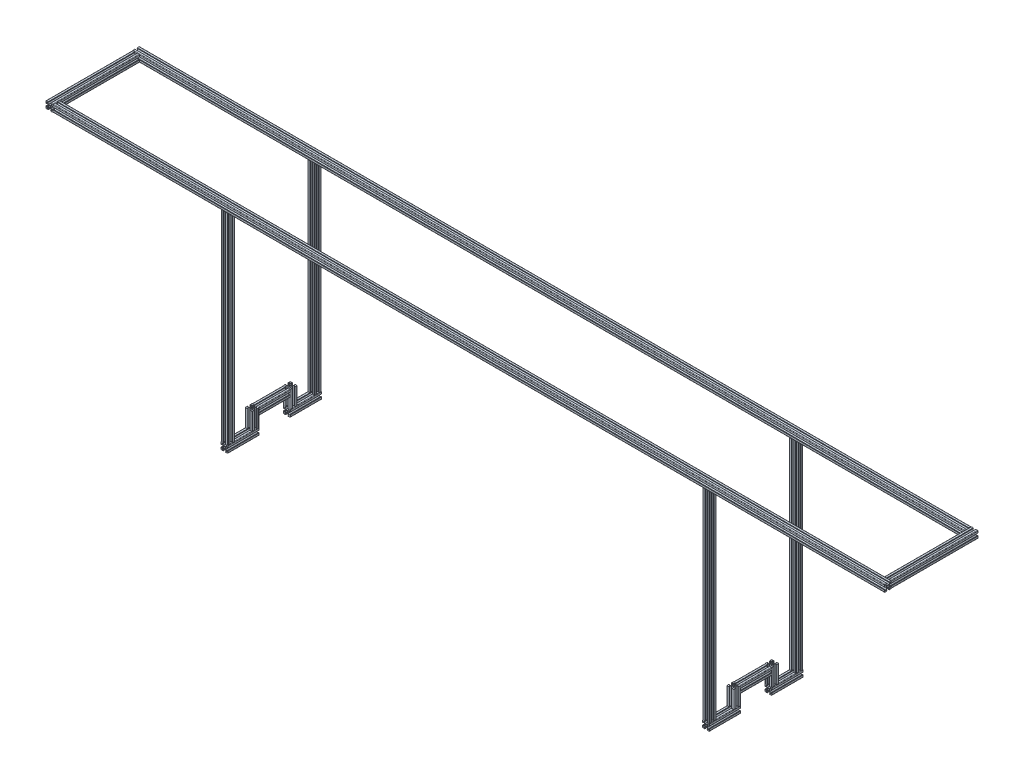
from build123d import *

# Parameters (mm, degrees)
F_20_X_20_X_R1_5_1_DEPTH      = 251
F_20_X_20_X_R1_5_1_DEPTH_BACK = 10
SKETCH14_R                    = 2.5
SKETCH14_ON_SEGMENT_2_R       = 2.5
F_20_X_20_X_R1_5_1_2_DEPTH    = 2411
SKETCH14_ON_SEGMENT_3_R       = 2.5
F_20_X_20_X_R1_5_1_3_DEPTH    = 261
SKETCH14_ON_SEGMENT_4_R       = 2.5
F_20_X_20_X_R1_5_1_4_DEPTH    = 2411
SKETCH14_ON_SEGMENT_5_R       = 2.5
F_20_X_20_X_R1_5_1_5_DEPTH    = 90
SKETCH14_ON_SEGMENT_6_R       = 2.5
F_20_X_20_X_R1_5_1_6_DEPTH    = 90
SKETCH14_ON_SEGMENT_7_R       = 2.5
F_20_X_20_X_R1_5_1_7_DEPTH    = 90
SKETCH14_ON_SEGMENT_8_R       = 2.5
F_20_X_20_X_R1_5_1_8_DEPTH    = 90
SKETCH14_ON_SEGMENT_9_R       = 2.5
F_20_X_20_X_R1_5_1_9_DEPTH    = 602
SKETCH14_ON_SEGMENT_10_R      = 2.5
F_20_X_20_X_R1_5_1_10_DEPTH   = 602
SKETCH14_ON_SEGMENT_11_R      = 2.5
F_20_X_20_X_R1_5_1_11_DEPTH   = 602
SKETCH14_ON_SEGMENT_12_R      = 2.5
F_20_X_20_X_R1_5_1_12_DEPTH   = 602
SKETCH14_ON_SEGMENT_13_R      = 2.5
F_20_X_20_X_R1_5_1_13_DEPTH   = 61
SKETCH14_ON_SEGMENT_14_R      = 2.5
F_20_X_20_X_R1_5_1_14_DEPTH   = 61
SKETCH14_ON_SEGMENT_15_R      = 2.5
F_20_X_20_X_R1_5_1_15_DEPTH   = 61
SKETCH14_ON_SEGMENT_16_R      = 2.5
F_20_X_20_X_R1_5_1_16_DEPTH   = 61
SKETCH14_ON_SEGMENT_17_R      = 2.5
F_20_X_20_X_R1_5_1_17_DEPTH   = 112
SKETCH14_ON_SEGMENT_18_R      = 2.5
F_20_X_20_X_R1_5_1_18_DEPTH   = 112


with BuildPart() as part:
    # Sketch14 → 工业铝型材 20 X 20 X R1.5(1) (new, two sides: drawn at the far end of the back side and taken through both)
    with BuildSketch(Plane(origin=(0, 600, 0), x_dir=(1, 0, 0), z_dir=(0, 0, -1)).offset(-F_20_X_20_X_R1_5_1_DEPTH_BACK)):
        with BuildLine():
            Line((-3.6, 10), (-3.6, 9.5))
            Line((-3.6, 9.5), (-3.1, 9.5))
            Line((-3.1, 9.5), (-3.1, 8.5))
            Line((-3.1, 8.5), (-5.5, 8.5))
            Line((-5.5, 8.5), (-5.5, 6.65))
            Line((-5.5, 6.65), (-2.75, 3.9))
            Line((-2.75, 3.9), (2.75, 3.9))
            Line((2.75, 3.9), (5.5, 6.65))
            Line((5.5, 6.65), (5.5, 8.5))
            Line((5.5, 8.5), (3.1, 8.5))
            Line((3.1, 8.5), (3.1, 9.5))
            Line((3.1, 9.5), (3.6, 9.5))
            Line((3.6, 9.5), (3.6, 10))
            Line((3.6, 10), (8.5, 10))
            ThreePointArc((8.5, 10), (9.560660172, 9.560660172), (10, 8.5))
            Line((10, 8.5), (10, 3.6))
            Line((10, 3.6), (9.5, 3.6))
            Line((9.5, 3.6), (9.5, 3.1))
            Line((9.5, 3.1), (8.5, 3.1))
            Line((8.5, 3.1), (8.5, 5.5))
            Line((8.5, 5.5), (6.65, 5.5))
            Line((6.65, 5.5), (3.9, 2.75))
            Line((3.9, 2.75), (3.9, -2.75))
            Line((3.9, -2.75), (6.65, -5.5))
            Line((6.65, -5.5), (8.5, -5.5))
            Line((8.5, -5.5), (8.5, -3.1))
            Line((8.5, -3.1), (9.5, -3.1))
            Line((9.5, -3.1), (9.5, -3.6))
            Line((9.5, -3.6), (10, -3.6))
            Line((10, -3.6), (10, -8.5))
            ThreePointArc((10, -8.5), (9.560660172, -9.560660172), (8.5, -10))
            Line((8.5, -10), (3.6, -10))
            Line((3.6, -10), (3.6, -9.5))
            Line((3.6, -9.5), (3.1, -9.5))
            Line((3.1, -9.5), (3.1, -8.5))
            Line((3.1, -8.5), (5.5, -8.5))
            Line((5.5, -8.5), (5.5, -6.65))
            Line((5.5, -6.65), (2.75, -3.9))
            Line((2.75, -3.9), (-2.75, -3.9))
            Line((-2.75, -3.9), (-5.5, -6.65))
            Line((-5.5, -6.65), (-5.5, -8.5))
            Line((-5.5, -8.5), (-3.1, -8.5))
            Line((-3.1, -8.5), (-3.1, -9.5))
            Line((-3.1, -9.5), (-3.6, -9.5))
            Line((-3.6, -9.5), (-3.6, -10))
            Line((-3.6, -10), (-8.5, -10))
            ThreePointArc((-8.5, -10), (-9.560660172, -9.560660172), (-10, -8.5))
            Line((-10, -8.5), (-10, -3.6))
            Line((-10, -3.6), (-9.5, -3.6))
            Line((-9.5, -3.6), (-9.5, -3.1))
            Line((-9.5, -3.1), (-8.5, -3.1))
            Line((-8.5, -3.1), (-8.5, -5.5))
            Line((-8.5, -5.5), (-6.65, -5.5))
            Line((-6.65, -5.5), (-3.9, -2.75))
            Line((-3.9, -2.75), (-3.9, 2.75))
            Line((-3.9, 2.75), (-6.65, 5.5))
            Line((-6.65, 5.5), (-8.5, 5.5))
            Line((-8.5, 5.5), (-8.5, 3.1))
            Line((-8.5, 3.1), (-9.5, 3.1))
            Line((-9.5, 3.1), (-9.5, 3.6))
            Line((-9.5, 3.6), (-10, 3.6))
            Line((-10, 3.6), (-10, 8.5))
            ThreePointArc((-10, 8.5), (-9.560660172, 9.560660172), (-8.5, 10))
            Line((-8.5, 10), (-3.6, 10))
        make_face()
        Circle(SKETCH14_R, mode=Mode.SUBTRACT)
    extrude(amount=F_20_X_20_X_R1_5_1_DEPTH + F_20_X_20_X_R1_5_1_DEPTH_BACK)

    # 工业铝型材 20 X 20 X R1.5(1) end butt 1
    split(bisect_by=Plane(origin=(0, 600, -240), x_dir=(0, -1, 0), z_dir=(0, 0, 1)), keep=Keep.TOP)


with BuildPart() as body_2:
    # Sketch14 on segment 2 (carried to segment 2) → 20 X 20 X R1.5_1 2 (new body)
    with BuildSketch(Plane(origin=(-10, 600, -250), x_dir=(0, 0, 1), z_dir=(1, 0, 0))):
        with BuildLine():
            Line((-3.6, 10), (-3.6, 9.5))
            Line((-3.6, 9.5), (-3.1, 9.5))
            Line((-3.1, 9.5), (-3.1, 8.5))
            Line((-3.1, 8.5), (-5.5, 8.5))
            Line((-5.5, 8.5), (-5.5, 6.65))
            Line((-5.5, 6.65), (-2.75, 3.9))
            Line((-2.75, 3.9), (2.75, 3.9))
            Line((2.75, 3.9), (5.5, 6.65))
            Line((5.5, 6.65), (5.5, 8.5))
            Line((5.5, 8.5), (3.1, 8.5))
            Line((3.1, 8.5), (3.1, 9.5))
            Line((3.1, 9.5), (3.6, 9.5))
            Line((3.6, 9.5), (3.6, 10))
            Line((3.6, 10), (8.5, 10))
            ThreePointArc((8.5, 10), (9.560660172, 9.560660172), (10, 8.5))
            Line((10, 8.5), (10, 3.6))
            Line((10, 3.6), (9.5, 3.6))
            Line((9.5, 3.6), (9.5, 3.1))
            Line((9.5, 3.1), (8.5, 3.1))
            Line((8.5, 3.1), (8.5, 5.5))
            Line((8.5, 5.5), (6.65, 5.5))
            Line((6.65, 5.5), (3.9, 2.75))
            Line((3.9, 2.75), (3.9, -2.75))
            Line((3.9, -2.75), (6.65, -5.5))
            Line((6.65, -5.5), (8.5, -5.5))
            Line((8.5, -5.5), (8.5, -3.1))
            Line((8.5, -3.1), (9.5, -3.1))
            Line((9.5, -3.1), (9.5, -3.6))
            Line((9.5, -3.6), (10, -3.6))
            Line((10, -3.6), (10, -8.5))
            ThreePointArc((10, -8.5), (9.560660172, -9.560660172), (8.5, -10))
            Line((8.5, -10), (3.6, -10))
            Line((3.6, -10), (3.6, -9.5))
            Line((3.6, -9.5), (3.1, -9.5))
            Line((3.1, -9.5), (3.1, -8.5))
            Line((3.1, -8.5), (5.5, -8.5))
            Line((5.5, -8.5), (5.5, -6.65))
            Line((5.5, -6.65), (2.75, -3.9))
            Line((2.75, -3.9), (-2.75, -3.9))
            Line((-2.75, -3.9), (-5.5, -6.65))
            Line((-5.5, -6.65), (-5.5, -8.5))
            Line((-5.5, -8.5), (-3.1, -8.5))
            Line((-3.1, -8.5), (-3.1, -9.5))
            Line((-3.1, -9.5), (-3.6, -9.5))
            Line((-3.6, -9.5), (-3.6, -10))
            Line((-3.6, -10), (-8.5, -10))
            ThreePointArc((-8.5, -10), (-9.560660172, -9.560660172), (-10, -8.5))
            Line((-10, -8.5), (-10, -3.6))
            Line((-10, -3.6), (-9.5, -3.6))
            Line((-9.5, -3.6), (-9.5, -3.1))
            Line((-9.5, -3.1), (-8.5, -3.1))
            Line((-8.5, -3.1), (-8.5, -5.5))
            Line((-8.5, -5.5), (-6.65, -5.5))
            Line((-6.65, -5.5), (-3.9, -2.75))
            Line((-3.9, -2.75), (-3.9, 2.75))
            Line((-3.9, 2.75), (-6.65, 5.5))
            Line((-6.65, 5.5), (-8.5, 5.5))
            Line((-8.5, 5.5), (-8.5, 3.1))
            Line((-8.5, 3.1), (-9.5, 3.1))
            Line((-9.5, 3.1), (-9.5, 3.6))
            Line((-9.5, 3.6), (-10, 3.6))
            Line((-10, 3.6), (-10, 8.5))
            ThreePointArc((-10, 8.5), (-9.560660172, 9.560660172), (-8.5, 10))
            Line((-8.5, 10), (-3.6, 10))
        make_face()
        Circle(SKETCH14_ON_SEGMENT_2_R, mode=Mode.SUBTRACT)
    extrude(amount=F_20_X_20_X_R1_5_1_2_DEPTH)

    # 20 X 20 X R1.5_1 2 end butt 1
    split(bisect_by=Plane(origin=(2390, 600, -250), x_dir=(0, -1, 0), z_dir=(-1, 0, 0)), keep=Keep.TOP)


with BuildPart() as body_3:
    # Sketch14 on segment 3 (carried to segment 3) → 20 X 20 X R1.5_1 3 (new body)
    with BuildSketch(Plane(origin=(2400, 600, -260), x_dir=(-1, 0, 0), z_dir=(0, 0, 1))):
        with BuildLine():
            Line((-3.6, 10), (-3.6, 9.5))
            Line((-3.6, 9.5), (-3.1, 9.5))
            Line((-3.1, 9.5), (-3.1, 8.5))
            Line((-3.1, 8.5), (-5.5, 8.5))
            Line((-5.5, 8.5), (-5.5, 6.65))
            Line((-5.5, 6.65), (-2.75, 3.9))
            Line((-2.75, 3.9), (2.75, 3.9))
            Line((2.75, 3.9), (5.5, 6.65))
            Line((5.5, 6.65), (5.5, 8.5))
            Line((5.5, 8.5), (3.1, 8.5))
            Line((3.1, 8.5), (3.1, 9.5))
            Line((3.1, 9.5), (3.6, 9.5))
            Line((3.6, 9.5), (3.6, 10))
            Line((3.6, 10), (8.5, 10))
            ThreePointArc((8.5, 10), (9.560660172, 9.560660172), (10, 8.5))
            Line((10, 8.5), (10, 3.6))
            Line((10, 3.6), (9.5, 3.6))
            Line((9.5, 3.6), (9.5, 3.1))
            Line((9.5, 3.1), (8.5, 3.1))
            Line((8.5, 3.1), (8.5, 5.5))
            Line((8.5, 5.5), (6.65, 5.5))
            Line((6.65, 5.5), (3.9, 2.75))
            Line((3.9, 2.75), (3.9, -2.75))
            Line((3.9, -2.75), (6.65, -5.5))
            Line((6.65, -5.5), (8.5, -5.5))
            Line((8.5, -5.5), (8.5, -3.1))
            Line((8.5, -3.1), (9.5, -3.1))
            Line((9.5, -3.1), (9.5, -3.6))
            Line((9.5, -3.6), (10, -3.6))
            Line((10, -3.6), (10, -8.5))
            ThreePointArc((10, -8.5), (9.560660172, -9.560660172), (8.5, -10))
            Line((8.5, -10), (3.6, -10))
            Line((3.6, -10), (3.6, -9.5))
            Line((3.6, -9.5), (3.1, -9.5))
            Line((3.1, -9.5), (3.1, -8.5))
            Line((3.1, -8.5), (5.5, -8.5))
            Line((5.5, -8.5), (5.5, -6.65))
            Line((5.5, -6.65), (2.75, -3.9))
            Line((2.75, -3.9), (-2.75, -3.9))
            Line((-2.75, -3.9), (-5.5, -6.65))
            Line((-5.5, -6.65), (-5.5, -8.5))
            Line((-5.5, -8.5), (-3.1, -8.5))
            Line((-3.1, -8.5), (-3.1, -9.5))
            Line((-3.1, -9.5), (-3.6, -9.5))
            Line((-3.6, -9.5), (-3.6, -10))
            Line((-3.6, -10), (-8.5, -10))
            ThreePointArc((-8.5, -10), (-9.560660172, -9.560660172), (-10, -8.5))
            Line((-10, -8.5), (-10, -3.6))
            Line((-10, -3.6), (-9.5, -3.6))
            Line((-9.5, -3.6), (-9.5, -3.1))
            Line((-9.5, -3.1), (-8.5, -3.1))
            Line((-8.5, -3.1), (-8.5, -5.5))
            Line((-8.5, -5.5), (-6.65, -5.5))
            Line((-6.65, -5.5), (-3.9, -2.75))
            Line((-3.9, -2.75), (-3.9, 2.75))
            Line((-3.9, 2.75), (-6.65, 5.5))
            Line((-6.65, 5.5), (-8.5, 5.5))
            Line((-8.5, 5.5), (-8.5, 3.1))
            Line((-8.5, 3.1), (-9.5, 3.1))
            Line((-9.5, 3.1), (-9.5, 3.6))
            Line((-9.5, 3.6), (-10, 3.6))
            Line((-10, 3.6), (-10, 8.5))
            ThreePointArc((-10, 8.5), (-9.560660172, 9.560660172), (-8.5, 10))
            Line((-8.5, 10), (-3.6, 10))
        make_face()
        Circle(SKETCH14_ON_SEGMENT_3_R, mode=Mode.SUBTRACT)
    extrude(amount=F_20_X_20_X_R1_5_1_3_DEPTH)

    # 20 X 20 X R1.5_1 3 end butt 1
    split(bisect_by=Plane(origin=(2400, 600, -10), x_dir=(0, 1, 0), z_dir=(0, 0, -1)), keep=Keep.TOP)


with BuildPart() as body_4:
    # Sketch14 on segment 4 (carried to segment 4) → 20 X 20 X R1.5_1 4 (new body)
    with BuildSketch(Plane(origin=(2410, 600, 0), x_dir=(0, 0, -1), z_dir=(-1, 0, 0))):
        with BuildLine():
            Line((-3.6, 10), (-3.6, 9.5))
            Line((-3.6, 9.5), (-3.1, 9.5))
            Line((-3.1, 9.5), (-3.1, 8.5))
            Line((-3.1, 8.5), (-5.5, 8.5))
            Line((-5.5, 8.5), (-5.5, 6.65))
            Line((-5.5, 6.65), (-2.75, 3.9))
            Line((-2.75, 3.9), (2.75, 3.9))
            Line((2.75, 3.9), (5.5, 6.65))
            Line((5.5, 6.65), (5.5, 8.5))
            Line((5.5, 8.5), (3.1, 8.5))
            Line((3.1, 8.5), (3.1, 9.5))
            Line((3.1, 9.5), (3.6, 9.5))
            Line((3.6, 9.5), (3.6, 10))
            Line((3.6, 10), (8.5, 10))
            ThreePointArc((8.5, 10), (9.560660172, 9.560660172), (10, 8.5))
            Line((10, 8.5), (10, 3.6))
            Line((10, 3.6), (9.5, 3.6))
            Line((9.5, 3.6), (9.5, 3.1))
            Line((9.5, 3.1), (8.5, 3.1))
            Line((8.5, 3.1), (8.5, 5.5))
            Line((8.5, 5.5), (6.65, 5.5))
            Line((6.65, 5.5), (3.9, 2.75))
            Line((3.9, 2.75), (3.9, -2.75))
            Line((3.9, -2.75), (6.65, -5.5))
            Line((6.65, -5.5), (8.5, -5.5))
            Line((8.5, -5.5), (8.5, -3.1))
            Line((8.5, -3.1), (9.5, -3.1))
            Line((9.5, -3.1), (9.5, -3.6))
            Line((9.5, -3.6), (10, -3.6))
            Line((10, -3.6), (10, -8.5))
            ThreePointArc((10, -8.5), (9.560660172, -9.560660172), (8.5, -10))
            Line((8.5, -10), (3.6, -10))
            Line((3.6, -10), (3.6, -9.5))
            Line((3.6, -9.5), (3.1, -9.5))
            Line((3.1, -9.5), (3.1, -8.5))
            Line((3.1, -8.5), (5.5, -8.5))
            Line((5.5, -8.5), (5.5, -6.65))
            Line((5.5, -6.65), (2.75, -3.9))
            Line((2.75, -3.9), (-2.75, -3.9))
            Line((-2.75, -3.9), (-5.5, -6.65))
            Line((-5.5, -6.65), (-5.5, -8.5))
            Line((-5.5, -8.5), (-3.1, -8.5))
            Line((-3.1, -8.5), (-3.1, -9.5))
            Line((-3.1, -9.5), (-3.6, -9.5))
            Line((-3.6, -9.5), (-3.6, -10))
            Line((-3.6, -10), (-8.5, -10))
            ThreePointArc((-8.5, -10), (-9.560660172, -9.560660172), (-10, -8.5))
            Line((-10, -8.5), (-10, -3.6))
            Line((-10, -3.6), (-9.5, -3.6))
            Line((-9.5, -3.6), (-9.5, -3.1))
            Line((-9.5, -3.1), (-8.5, -3.1))
            Line((-8.5, -3.1), (-8.5, -5.5))
            Line((-8.5, -5.5), (-6.65, -5.5))
            Line((-6.65, -5.5), (-3.9, -2.75))
            Line((-3.9, -2.75), (-3.9, 2.75))
            Line((-3.9, 2.75), (-6.65, 5.5))
            Line((-6.65, 5.5), (-8.5, 5.5))
            Line((-8.5, 5.5), (-8.5, 3.1))
            Line((-8.5, 3.1), (-9.5, 3.1))
            Line((-9.5, 3.1), (-9.5, 3.6))
            Line((-9.5, 3.6), (-10, 3.6))
            Line((-10, 3.6), (-10, 8.5))
            ThreePointArc((-10, 8.5), (-9.560660172, 9.560660172), (-8.5, 10))
            Line((-8.5, 10), (-3.6, 10))
        make_face()
        Circle(SKETCH14_ON_SEGMENT_4_R, mode=Mode.SUBTRACT)
    extrude(amount=F_20_X_20_X_R1_5_1_4_DEPTH)

    # 20 X 20 X R1.5_1 4 end butt 1
    split(bisect_by=Plane(origin=(10, 600, 0), x_dir=(0, 1, 0), z_dir=(1, 0, 0)), keep=Keep.TOP)


with BuildPart() as body_5:
    # Sketch14 on segment 5 (carried to segment 5) → 20 X 20 X R1.5_1 5 (new body)
    with BuildSketch(Plane(origin=(505, 0, 10), x_dir=(1, 0, 0), z_dir=(0, 0, -1))):
        with BuildLine():
            Line((-3.6, 10), (-3.6, 9.5))
            Line((-3.6, 9.5), (-3.1, 9.5))
            Line((-3.1, 9.5), (-3.1, 8.5))
            Line((-3.1, 8.5), (-5.5, 8.5))
            Line((-5.5, 8.5), (-5.5, 6.65))
            Line((-5.5, 6.65), (-2.75, 3.9))
            Line((-2.75, 3.9), (2.75, 3.9))
            Line((2.75, 3.9), (5.5, 6.65))
            Line((5.5, 6.65), (5.5, 8.5))
            Line((5.5, 8.5), (3.1, 8.5))
            Line((3.1, 8.5), (3.1, 9.5))
            Line((3.1, 9.5), (3.6, 9.5))
            Line((3.6, 9.5), (3.6, 10))
            Line((3.6, 10), (8.5, 10))
            ThreePointArc((8.5, 10), (9.560660172, 9.560660172), (10, 8.5))
            Line((10, 8.5), (10, 3.6))
            Line((10, 3.6), (9.5, 3.6))
            Line((9.5, 3.6), (9.5, 3.1))
            Line((9.5, 3.1), (8.5, 3.1))
            Line((8.5, 3.1), (8.5, 5.5))
            Line((8.5, 5.5), (6.65, 5.5))
            Line((6.65, 5.5), (3.9, 2.75))
            Line((3.9, 2.75), (3.9, -2.75))
            Line((3.9, -2.75), (6.65, -5.5))
            Line((6.65, -5.5), (8.5, -5.5))
            Line((8.5, -5.5), (8.5, -3.1))
            Line((8.5, -3.1), (9.5, -3.1))
            Line((9.5, -3.1), (9.5, -3.6))
            Line((9.5, -3.6), (10, -3.6))
            Line((10, -3.6), (10, -8.5))
            ThreePointArc((10, -8.5), (9.560660172, -9.560660172), (8.5, -10))
            Line((8.5, -10), (3.6, -10))
            Line((3.6, -10), (3.6, -9.5))
            Line((3.6, -9.5), (3.1, -9.5))
            Line((3.1, -9.5), (3.1, -8.5))
            Line((3.1, -8.5), (5.5, -8.5))
            Line((5.5, -8.5), (5.5, -6.65))
            Line((5.5, -6.65), (2.75, -3.9))
            Line((2.75, -3.9), (-2.75, -3.9))
            Line((-2.75, -3.9), (-5.5, -6.65))
            Line((-5.5, -6.65), (-5.5, -8.5))
            Line((-5.5, -8.5), (-3.1, -8.5))
            Line((-3.1, -8.5), (-3.1, -9.5))
            Line((-3.1, -9.5), (-3.6, -9.5))
            Line((-3.6, -9.5), (-3.6, -10))
            Line((-3.6, -10), (-8.5, -10))
            ThreePointArc((-8.5, -10), (-9.560660172, -9.560660172), (-10, -8.5))
            Line((-10, -8.5), (-10, -3.6))
            Line((-10, -3.6), (-9.5, -3.6))
            Line((-9.5, -3.6), (-9.5, -3.1))
            Line((-9.5, -3.1), (-8.5, -3.1))
            Line((-8.5, -3.1), (-8.5, -5.5))
            Line((-8.5, -5.5), (-6.65, -5.5))
            Line((-6.65, -5.5), (-3.9, -2.75))
            Line((-3.9, -2.75), (-3.9, 2.75))
            Line((-3.9, 2.75), (-6.65, 5.5))
            Line((-6.65, 5.5), (-8.5, 5.5))
            Line((-8.5, 5.5), (-8.5, 3.1))
            Line((-8.5, 3.1), (-9.5, 3.1))
            Line((-9.5, 3.1), (-9.5, 3.6))
            Line((-9.5, 3.6), (-10, 3.6))
            Line((-10, 3.6), (-10, 8.5))
            ThreePointArc((-10, 8.5), (-9.560660172, 9.560660172), (-8.5, 10))
            Line((-8.5, 10), (-3.6, 10))
        make_face()
        Circle(SKETCH14_ON_SEGMENT_5_R, mode=Mode.SUBTRACT)
    extrude(amount=F_20_X_20_X_R1_5_1_5_DEPTH)


with BuildPart() as body_6:
    # Sketch14 on segment 6 (carried to segment 6) → 20 X 20 X R1.5_1 6 (new body)
    with BuildSketch(Plane(origin=(1895, 0, 10), x_dir=(1, 0, 0), z_dir=(0, 0, -1))):
        with BuildLine():
            Line((-3.6, 10), (-3.6, 9.5))
            Line((-3.6, 9.5), (-3.1, 9.5))
            Line((-3.1, 9.5), (-3.1, 8.5))
            Line((-3.1, 8.5), (-5.5, 8.5))
            Line((-5.5, 8.5), (-5.5, 6.65))
            Line((-5.5, 6.65), (-2.75, 3.9))
            Line((-2.75, 3.9), (2.75, 3.9))
            Line((2.75, 3.9), (5.5, 6.65))
            Line((5.5, 6.65), (5.5, 8.5))
            Line((5.5, 8.5), (3.1, 8.5))
            Line((3.1, 8.5), (3.1, 9.5))
            Line((3.1, 9.5), (3.6, 9.5))
            Line((3.6, 9.5), (3.6, 10))
            Line((3.6, 10), (8.5, 10))
            ThreePointArc((8.5, 10), (9.560660172, 9.560660172), (10, 8.5))
            Line((10, 8.5), (10, 3.6))
            Line((10, 3.6), (9.5, 3.6))
            Line((9.5, 3.6), (9.5, 3.1))
            Line((9.5, 3.1), (8.5, 3.1))
            Line((8.5, 3.1), (8.5, 5.5))
            Line((8.5, 5.5), (6.65, 5.5))
            Line((6.65, 5.5), (3.9, 2.75))
            Line((3.9, 2.75), (3.9, -2.75))
            Line((3.9, -2.75), (6.65, -5.5))
            Line((6.65, -5.5), (8.5, -5.5))
            Line((8.5, -5.5), (8.5, -3.1))
            Line((8.5, -3.1), (9.5, -3.1))
            Line((9.5, -3.1), (9.5, -3.6))
            Line((9.5, -3.6), (10, -3.6))
            Line((10, -3.6), (10, -8.5))
            ThreePointArc((10, -8.5), (9.560660172, -9.560660172), (8.5, -10))
            Line((8.5, -10), (3.6, -10))
            Line((3.6, -10), (3.6, -9.5))
            Line((3.6, -9.5), (3.1, -9.5))
            Line((3.1, -9.5), (3.1, -8.5))
            Line((3.1, -8.5), (5.5, -8.5))
            Line((5.5, -8.5), (5.5, -6.65))
            Line((5.5, -6.65), (2.75, -3.9))
            Line((2.75, -3.9), (-2.75, -3.9))
            Line((-2.75, -3.9), (-5.5, -6.65))
            Line((-5.5, -6.65), (-5.5, -8.5))
            Line((-5.5, -8.5), (-3.1, -8.5))
            Line((-3.1, -8.5), (-3.1, -9.5))
            Line((-3.1, -9.5), (-3.6, -9.5))
            Line((-3.6, -9.5), (-3.6, -10))
            Line((-3.6, -10), (-8.5, -10))
            ThreePointArc((-8.5, -10), (-9.560660172, -9.560660172), (-10, -8.5))
            Line((-10, -8.5), (-10, -3.6))
            Line((-10, -3.6), (-9.5, -3.6))
            Line((-9.5, -3.6), (-9.5, -3.1))
            Line((-9.5, -3.1), (-8.5, -3.1))
            Line((-8.5, -3.1), (-8.5, -5.5))
            Line((-8.5, -5.5), (-6.65, -5.5))
            Line((-6.65, -5.5), (-3.9, -2.75))
            Line((-3.9, -2.75), (-3.9, 2.75))
            Line((-3.9, 2.75), (-6.65, 5.5))
            Line((-6.65, 5.5), (-8.5, 5.5))
            Line((-8.5, 5.5), (-8.5, 3.1))
            Line((-8.5, 3.1), (-9.5, 3.1))
            Line((-9.5, 3.1), (-9.5, 3.6))
            Line((-9.5, 3.6), (-10, 3.6))
            Line((-10, 3.6), (-10, 8.5))
            ThreePointArc((-10, 8.5), (-9.560660172, 9.560660172), (-8.5, 10))
            Line((-8.5, 10), (-3.6, 10))
        make_face()
        Circle(SKETCH14_ON_SEGMENT_6_R, mode=Mode.SUBTRACT)
    extrude(amount=F_20_X_20_X_R1_5_1_6_DEPTH)


with BuildPart() as body_7:
    # Sketch14 on segment 7 (carried to segment 7) → 20 X 20 X R1.5_1 7 (new body)
    with BuildSketch(Plane(origin=(505, 0, -170), x_dir=(1, 0, 0), z_dir=(0, 0, -1))):
        with BuildLine():
            Line((-3.6, 10), (-3.6, 9.5))
            Line((-3.6, 9.5), (-3.1, 9.5))
            Line((-3.1, 9.5), (-3.1, 8.5))
            Line((-3.1, 8.5), (-5.5, 8.5))
            Line((-5.5, 8.5), (-5.5, 6.65))
            Line((-5.5, 6.65), (-2.75, 3.9))
            Line((-2.75, 3.9), (2.75, 3.9))
            Line((2.75, 3.9), (5.5, 6.65))
            Line((5.5, 6.65), (5.5, 8.5))
            Line((5.5, 8.5), (3.1, 8.5))
            Line((3.1, 8.5), (3.1, 9.5))
            Line((3.1, 9.5), (3.6, 9.5))
            Line((3.6, 9.5), (3.6, 10))
            Line((3.6, 10), (8.5, 10))
            ThreePointArc((8.5, 10), (9.560660172, 9.560660172), (10, 8.5))
            Line((10, 8.5), (10, 3.6))
            Line((10, 3.6), (9.5, 3.6))
            Line((9.5, 3.6), (9.5, 3.1))
            Line((9.5, 3.1), (8.5, 3.1))
            Line((8.5, 3.1), (8.5, 5.5))
            Line((8.5, 5.5), (6.65, 5.5))
            Line((6.65, 5.5), (3.9, 2.75))
            Line((3.9, 2.75), (3.9, -2.75))
            Line((3.9, -2.75), (6.65, -5.5))
            Line((6.65, -5.5), (8.5, -5.5))
            Line((8.5, -5.5), (8.5, -3.1))
            Line((8.5, -3.1), (9.5, -3.1))
            Line((9.5, -3.1), (9.5, -3.6))
            Line((9.5, -3.6), (10, -3.6))
            Line((10, -3.6), (10, -8.5))
            ThreePointArc((10, -8.5), (9.560660172, -9.560660172), (8.5, -10))
            Line((8.5, -10), (3.6, -10))
            Line((3.6, -10), (3.6, -9.5))
            Line((3.6, -9.5), (3.1, -9.5))
            Line((3.1, -9.5), (3.1, -8.5))
            Line((3.1, -8.5), (5.5, -8.5))
            Line((5.5, -8.5), (5.5, -6.65))
            Line((5.5, -6.65), (2.75, -3.9))
            Line((2.75, -3.9), (-2.75, -3.9))
            Line((-2.75, -3.9), (-5.5, -6.65))
            Line((-5.5, -6.65), (-5.5, -8.5))
            Line((-5.5, -8.5), (-3.1, -8.5))
            Line((-3.1, -8.5), (-3.1, -9.5))
            Line((-3.1, -9.5), (-3.6, -9.5))
            Line((-3.6, -9.5), (-3.6, -10))
            Line((-3.6, -10), (-8.5, -10))
            ThreePointArc((-8.5, -10), (-9.560660172, -9.560660172), (-10, -8.5))
            Line((-10, -8.5), (-10, -3.6))
            Line((-10, -3.6), (-9.5, -3.6))
            Line((-9.5, -3.6), (-9.5, -3.1))
            Line((-9.5, -3.1), (-8.5, -3.1))
            Line((-8.5, -3.1), (-8.5, -5.5))
            Line((-8.5, -5.5), (-6.65, -5.5))
            Line((-6.65, -5.5), (-3.9, -2.75))
            Line((-3.9, -2.75), (-3.9, 2.75))
            Line((-3.9, 2.75), (-6.65, 5.5))
            Line((-6.65, 5.5), (-8.5, 5.5))
            Line((-8.5, 5.5), (-8.5, 3.1))
            Line((-8.5, 3.1), (-9.5, 3.1))
            Line((-9.5, 3.1), (-9.5, 3.6))
            Line((-9.5, 3.6), (-10, 3.6))
            Line((-10, 3.6), (-10, 8.5))
            ThreePointArc((-10, 8.5), (-9.560660172, 9.560660172), (-8.5, 10))
            Line((-8.5, 10), (-3.6, 10))
        make_face()
        Circle(SKETCH14_ON_SEGMENT_7_R, mode=Mode.SUBTRACT)
    extrude(amount=F_20_X_20_X_R1_5_1_7_DEPTH)


with BuildPart() as body_8:
    # Sketch14 on segment 8 (carried to segment 8) → 20 X 20 X R1.5_1 8 (new body)
    with BuildSketch(Plane(origin=(1895, 0, -170), x_dir=(1, 0, 0), z_dir=(0, 0, -1))):
        with BuildLine():
            Line((-3.6, 10), (-3.6, 9.5))
            Line((-3.6, 9.5), (-3.1, 9.5))
            Line((-3.1, 9.5), (-3.1, 8.5))
            Line((-3.1, 8.5), (-5.5, 8.5))
            Line((-5.5, 8.5), (-5.5, 6.65))
            Line((-5.5, 6.65), (-2.75, 3.9))
            Line((-2.75, 3.9), (2.75, 3.9))
            Line((2.75, 3.9), (5.5, 6.65))
            Line((5.5, 6.65), (5.5, 8.5))
            Line((5.5, 8.5), (3.1, 8.5))
            Line((3.1, 8.5), (3.1, 9.5))
            Line((3.1, 9.5), (3.6, 9.5))
            Line((3.6, 9.5), (3.6, 10))
            Line((3.6, 10), (8.5, 10))
            ThreePointArc((8.5, 10), (9.560660172, 9.560660172), (10, 8.5))
            Line((10, 8.5), (10, 3.6))
            Line((10, 3.6), (9.5, 3.6))
            Line((9.5, 3.6), (9.5, 3.1))
            Line((9.5, 3.1), (8.5, 3.1))
            Line((8.5, 3.1), (8.5, 5.5))
            Line((8.5, 5.5), (6.65, 5.5))
            Line((6.65, 5.5), (3.9, 2.75))
            Line((3.9, 2.75), (3.9, -2.75))
            Line((3.9, -2.75), (6.65, -5.5))
            Line((6.65, -5.5), (8.5, -5.5))
            Line((8.5, -5.5), (8.5, -3.1))
            Line((8.5, -3.1), (9.5, -3.1))
            Line((9.5, -3.1), (9.5, -3.6))
            Line((9.5, -3.6), (10, -3.6))
            Line((10, -3.6), (10, -8.5))
            ThreePointArc((10, -8.5), (9.560660172, -9.560660172), (8.5, -10))
            Line((8.5, -10), (3.6, -10))
            Line((3.6, -10), (3.6, -9.5))
            Line((3.6, -9.5), (3.1, -9.5))
            Line((3.1, -9.5), (3.1, -8.5))
            Line((3.1, -8.5), (5.5, -8.5))
            Line((5.5, -8.5), (5.5, -6.65))
            Line((5.5, -6.65), (2.75, -3.9))
            Line((2.75, -3.9), (-2.75, -3.9))
            Line((-2.75, -3.9), (-5.5, -6.65))
            Line((-5.5, -6.65), (-5.5, -8.5))
            Line((-5.5, -8.5), (-3.1, -8.5))
            Line((-3.1, -8.5), (-3.1, -9.5))
            Line((-3.1, -9.5), (-3.6, -9.5))
            Line((-3.6, -9.5), (-3.6, -10))
            Line((-3.6, -10), (-8.5, -10))
            ThreePointArc((-8.5, -10), (-9.560660172, -9.560660172), (-10, -8.5))
            Line((-10, -8.5), (-10, -3.6))
            Line((-10, -3.6), (-9.5, -3.6))
            Line((-9.5, -3.6), (-9.5, -3.1))
            Line((-9.5, -3.1), (-8.5, -3.1))
            Line((-8.5, -3.1), (-8.5, -5.5))
            Line((-8.5, -5.5), (-6.65, -5.5))
            Line((-6.65, -5.5), (-3.9, -2.75))
            Line((-3.9, -2.75), (-3.9, 2.75))
            Line((-3.9, 2.75), (-6.65, 5.5))
            Line((-6.65, 5.5), (-8.5, 5.5))
            Line((-8.5, 5.5), (-8.5, 3.1))
            Line((-8.5, 3.1), (-9.5, 3.1))
            Line((-9.5, 3.1), (-9.5, 3.6))
            Line((-9.5, 3.6), (-10, 3.6))
            Line((-10, 3.6), (-10, 8.5))
            ThreePointArc((-10, 8.5), (-9.560660172, 9.560660172), (-8.5, 10))
            Line((-8.5, 10), (-3.6, 10))
        make_face()
        Circle(SKETCH14_ON_SEGMENT_8_R, mode=Mode.SUBTRACT)
    extrude(amount=F_20_X_20_X_R1_5_1_8_DEPTH)


with BuildPart() as body_9:
    # Sketch14 on segment 9 (carried to segment 9) → 20 X 20 X R1.5_1 9 (new body)
    with BuildSketch(Plane(origin=(505, 601, 0), x_dir=(1, 0, 0), z_dir=(0, -1, 0))):
        with BuildLine():
            Line((-3.6, 10), (-3.6, 9.5))
            Line((-3.6, 9.5), (-3.1, 9.5))
            Line((-3.1, 9.5), (-3.1, 8.5))
            Line((-3.1, 8.5), (-5.5, 8.5))
            Line((-5.5, 8.5), (-5.5, 6.65))
            Line((-5.5, 6.65), (-2.75, 3.9))
            Line((-2.75, 3.9), (2.75, 3.9))
            Line((2.75, 3.9), (5.5, 6.65))
            Line((5.5, 6.65), (5.5, 8.5))
            Line((5.5, 8.5), (3.1, 8.5))
            Line((3.1, 8.5), (3.1, 9.5))
            Line((3.1, 9.5), (3.6, 9.5))
            Line((3.6, 9.5), (3.6, 10))
            Line((3.6, 10), (8.5, 10))
            ThreePointArc((8.5, 10), (9.560660172, 9.560660172), (10, 8.5))
            Line((10, 8.5), (10, 3.6))
            Line((10, 3.6), (9.5, 3.6))
            Line((9.5, 3.6), (9.5, 3.1))
            Line((9.5, 3.1), (8.5, 3.1))
            Line((8.5, 3.1), (8.5, 5.5))
            Line((8.5, 5.5), (6.65, 5.5))
            Line((6.65, 5.5), (3.9, 2.75))
            Line((3.9, 2.75), (3.9, -2.75))
            Line((3.9, -2.75), (6.65, -5.5))
            Line((6.65, -5.5), (8.5, -5.5))
            Line((8.5, -5.5), (8.5, -3.1))
            Line((8.5, -3.1), (9.5, -3.1))
            Line((9.5, -3.1), (9.5, -3.6))
            Line((9.5, -3.6), (10, -3.6))
            Line((10, -3.6), (10, -8.5))
            ThreePointArc((10, -8.5), (9.560660172, -9.560660172), (8.5, -10))
            Line((8.5, -10), (3.6, -10))
            Line((3.6, -10), (3.6, -9.5))
            Line((3.6, -9.5), (3.1, -9.5))
            Line((3.1, -9.5), (3.1, -8.5))
            Line((3.1, -8.5), (5.5, -8.5))
            Line((5.5, -8.5), (5.5, -6.65))
            Line((5.5, -6.65), (2.75, -3.9))
            Line((2.75, -3.9), (-2.75, -3.9))
            Line((-2.75, -3.9), (-5.5, -6.65))
            Line((-5.5, -6.65), (-5.5, -8.5))
            Line((-5.5, -8.5), (-3.1, -8.5))
            Line((-3.1, -8.5), (-3.1, -9.5))
            Line((-3.1, -9.5), (-3.6, -9.5))
            Line((-3.6, -9.5), (-3.6, -10))
            Line((-3.6, -10), (-8.5, -10))
            ThreePointArc((-8.5, -10), (-9.560660172, -9.560660172), (-10, -8.5))
            Line((-10, -8.5), (-10, -3.6))
            Line((-10, -3.6), (-9.5, -3.6))
            Line((-9.5, -3.6), (-9.5, -3.1))
            Line((-9.5, -3.1), (-8.5, -3.1))
            Line((-8.5, -3.1), (-8.5, -5.5))
            Line((-8.5, -5.5), (-6.65, -5.5))
            Line((-6.65, -5.5), (-3.9, -2.75))
            Line((-3.9, -2.75), (-3.9, 2.75))
            Line((-3.9, 2.75), (-6.65, 5.5))
            Line((-6.65, 5.5), (-8.5, 5.5))
            Line((-8.5, 5.5), (-8.5, 3.1))
            Line((-8.5, 3.1), (-9.5, 3.1))
            Line((-9.5, 3.1), (-9.5, 3.6))
            Line((-9.5, 3.6), (-10, 3.6))
            Line((-10, 3.6), (-10, 8.5))
            ThreePointArc((-10, 8.5), (-9.560660172, 9.560660172), (-8.5, 10))
            Line((-8.5, 10), (-3.6, 10))
        make_face()
        Circle(SKETCH14_ON_SEGMENT_9_R, mode=Mode.SUBTRACT)
    extrude(amount=F_20_X_20_X_R1_5_1_9_DEPTH)

    # 20 X 20 X R1.5_1 9 end butt 1
    split(bisect_by=Plane(origin=(505, 590, 0), x_dir=(1, 0, 0), z_dir=(0, -1, 0)), keep=Keep.TOP)

    # 20 X 20 X R1.5_1 9 end butt 2
    split(bisect_by=Plane(origin=(505, 10, 0), x_dir=(-1, 0, 0), z_dir=(0, 1, 0)), keep=Keep.TOP)


with BuildPart() as body_10:
    # Sketch14 on segment 10 (carried to segment 10) → 20 X 20 X R1.5_1 10 (new body)
    with BuildSketch(Plane(origin=(505, 601, -250), x_dir=(1, 0, 0), z_dir=(0, -1, 0))):
        with BuildLine():
            Line((-3.6, 10), (-3.6, 9.5))
            Line((-3.6, 9.5), (-3.1, 9.5))
            Line((-3.1, 9.5), (-3.1, 8.5))
            Line((-3.1, 8.5), (-5.5, 8.5))
            Line((-5.5, 8.5), (-5.5, 6.65))
            Line((-5.5, 6.65), (-2.75, 3.9))
            Line((-2.75, 3.9), (2.75, 3.9))
            Line((2.75, 3.9), (5.5, 6.65))
            Line((5.5, 6.65), (5.5, 8.5))
            Line((5.5, 8.5), (3.1, 8.5))
            Line((3.1, 8.5), (3.1, 9.5))
            Line((3.1, 9.5), (3.6, 9.5))
            Line((3.6, 9.5), (3.6, 10))
            Line((3.6, 10), (8.5, 10))
            ThreePointArc((8.5, 10), (9.560660172, 9.560660172), (10, 8.5))
            Line((10, 8.5), (10, 3.6))
            Line((10, 3.6), (9.5, 3.6))
            Line((9.5, 3.6), (9.5, 3.1))
            Line((9.5, 3.1), (8.5, 3.1))
            Line((8.5, 3.1), (8.5, 5.5))
            Line((8.5, 5.5), (6.65, 5.5))
            Line((6.65, 5.5), (3.9, 2.75))
            Line((3.9, 2.75), (3.9, -2.75))
            Line((3.9, -2.75), (6.65, -5.5))
            Line((6.65, -5.5), (8.5, -5.5))
            Line((8.5, -5.5), (8.5, -3.1))
            Line((8.5, -3.1), (9.5, -3.1))
            Line((9.5, -3.1), (9.5, -3.6))
            Line((9.5, -3.6), (10, -3.6))
            Line((10, -3.6), (10, -8.5))
            ThreePointArc((10, -8.5), (9.560660172, -9.560660172), (8.5, -10))
            Line((8.5, -10), (3.6, -10))
            Line((3.6, -10), (3.6, -9.5))
            Line((3.6, -9.5), (3.1, -9.5))
            Line((3.1, -9.5), (3.1, -8.5))
            Line((3.1, -8.5), (5.5, -8.5))
            Line((5.5, -8.5), (5.5, -6.65))
            Line((5.5, -6.65), (2.75, -3.9))
            Line((2.75, -3.9), (-2.75, -3.9))
            Line((-2.75, -3.9), (-5.5, -6.65))
            Line((-5.5, -6.65), (-5.5, -8.5))
            Line((-5.5, -8.5), (-3.1, -8.5))
            Line((-3.1, -8.5), (-3.1, -9.5))
            Line((-3.1, -9.5), (-3.6, -9.5))
            Line((-3.6, -9.5), (-3.6, -10))
            Line((-3.6, -10), (-8.5, -10))
            ThreePointArc((-8.5, -10), (-9.560660172, -9.560660172), (-10, -8.5))
            Line((-10, -8.5), (-10, -3.6))
            Line((-10, -3.6), (-9.5, -3.6))
            Line((-9.5, -3.6), (-9.5, -3.1))
            Line((-9.5, -3.1), (-8.5, -3.1))
            Line((-8.5, -3.1), (-8.5, -5.5))
            Line((-8.5, -5.5), (-6.65, -5.5))
            Line((-6.65, -5.5), (-3.9, -2.75))
            Line((-3.9, -2.75), (-3.9, 2.75))
            Line((-3.9, 2.75), (-6.65, 5.5))
            Line((-6.65, 5.5), (-8.5, 5.5))
            Line((-8.5, 5.5), (-8.5, 3.1))
            Line((-8.5, 3.1), (-9.5, 3.1))
            Line((-9.5, 3.1), (-9.5, 3.6))
            Line((-9.5, 3.6), (-10, 3.6))
            Line((-10, 3.6), (-10, 8.5))
            ThreePointArc((-10, 8.5), (-9.560660172, 9.560660172), (-8.5, 10))
            Line((-8.5, 10), (-3.6, 10))
        make_face()
        Circle(SKETCH14_ON_SEGMENT_10_R, mode=Mode.SUBTRACT)
    extrude(amount=F_20_X_20_X_R1_5_1_10_DEPTH)

    # 20 X 20 X R1.5_1 10 end butt 1
    split(bisect_by=Plane(origin=(505, 590, -250), x_dir=(1, 0, 0), z_dir=(0, -1, 0)), keep=Keep.TOP)

    # 20 X 20 X R1.5_1 10 end butt 2
    split(bisect_by=Plane(origin=(505, 10, -250), x_dir=(-1, 0, 0), z_dir=(0, 1, 0)), keep=Keep.TOP)


with BuildPart() as body_11:
    # Sketch14 on segment 11 (carried to segment 11) → 20 X 20 X R1.5_1 11 (new body)
    with BuildSketch(Plane(origin=(1895, 601, 0), x_dir=(1, 0, 0), z_dir=(0, -1, 0))):
        with BuildLine():
            Line((-3.6, 10), (-3.6, 9.5))
            Line((-3.6, 9.5), (-3.1, 9.5))
            Line((-3.1, 9.5), (-3.1, 8.5))
            Line((-3.1, 8.5), (-5.5, 8.5))
            Line((-5.5, 8.5), (-5.5, 6.65))
            Line((-5.5, 6.65), (-2.75, 3.9))
            Line((-2.75, 3.9), (2.75, 3.9))
            Line((2.75, 3.9), (5.5, 6.65))
            Line((5.5, 6.65), (5.5, 8.5))
            Line((5.5, 8.5), (3.1, 8.5))
            Line((3.1, 8.5), (3.1, 9.5))
            Line((3.1, 9.5), (3.6, 9.5))
            Line((3.6, 9.5), (3.6, 10))
            Line((3.6, 10), (8.5, 10))
            ThreePointArc((8.5, 10), (9.560660172, 9.560660172), (10, 8.5))
            Line((10, 8.5), (10, 3.6))
            Line((10, 3.6), (9.5, 3.6))
            Line((9.5, 3.6), (9.5, 3.1))
            Line((9.5, 3.1), (8.5, 3.1))
            Line((8.5, 3.1), (8.5, 5.5))
            Line((8.5, 5.5), (6.65, 5.5))
            Line((6.65, 5.5), (3.9, 2.75))
            Line((3.9, 2.75), (3.9, -2.75))
            Line((3.9, -2.75), (6.65, -5.5))
            Line((6.65, -5.5), (8.5, -5.5))
            Line((8.5, -5.5), (8.5, -3.1))
            Line((8.5, -3.1), (9.5, -3.1))
            Line((9.5, -3.1), (9.5, -3.6))
            Line((9.5, -3.6), (10, -3.6))
            Line((10, -3.6), (10, -8.5))
            ThreePointArc((10, -8.5), (9.560660172, -9.560660172), (8.5, -10))
            Line((8.5, -10), (3.6, -10))
            Line((3.6, -10), (3.6, -9.5))
            Line((3.6, -9.5), (3.1, -9.5))
            Line((3.1, -9.5), (3.1, -8.5))
            Line((3.1, -8.5), (5.5, -8.5))
            Line((5.5, -8.5), (5.5, -6.65))
            Line((5.5, -6.65), (2.75, -3.9))
            Line((2.75, -3.9), (-2.75, -3.9))
            Line((-2.75, -3.9), (-5.5, -6.65))
            Line((-5.5, -6.65), (-5.5, -8.5))
            Line((-5.5, -8.5), (-3.1, -8.5))
            Line((-3.1, -8.5), (-3.1, -9.5))
            Line((-3.1, -9.5), (-3.6, -9.5))
            Line((-3.6, -9.5), (-3.6, -10))
            Line((-3.6, -10), (-8.5, -10))
            ThreePointArc((-8.5, -10), (-9.560660172, -9.560660172), (-10, -8.5))
            Line((-10, -8.5), (-10, -3.6))
            Line((-10, -3.6), (-9.5, -3.6))
            Line((-9.5, -3.6), (-9.5, -3.1))
            Line((-9.5, -3.1), (-8.5, -3.1))
            Line((-8.5, -3.1), (-8.5, -5.5))
            Line((-8.5, -5.5), (-6.65, -5.5))
            Line((-6.65, -5.5), (-3.9, -2.75))
            Line((-3.9, -2.75), (-3.9, 2.75))
            Line((-3.9, 2.75), (-6.65, 5.5))
            Line((-6.65, 5.5), (-8.5, 5.5))
            Line((-8.5, 5.5), (-8.5, 3.1))
            Line((-8.5, 3.1), (-9.5, 3.1))
            Line((-9.5, 3.1), (-9.5, 3.6))
            Line((-9.5, 3.6), (-10, 3.6))
            Line((-10, 3.6), (-10, 8.5))
            ThreePointArc((-10, 8.5), (-9.560660172, 9.560660172), (-8.5, 10))
            Line((-8.5, 10), (-3.6, 10))
        make_face()
        Circle(SKETCH14_ON_SEGMENT_11_R, mode=Mode.SUBTRACT)
    extrude(amount=F_20_X_20_X_R1_5_1_11_DEPTH)

    # 20 X 20 X R1.5_1 11 end butt 1
    split(bisect_by=Plane(origin=(1895, 590, 0), x_dir=(1, 0, 0), z_dir=(0, -1, 0)), keep=Keep.TOP)

    # 20 X 20 X R1.5_1 11 end butt 2
    split(bisect_by=Plane(origin=(1895, 10, 0), x_dir=(-1, 0, 0), z_dir=(0, 1, 0)), keep=Keep.TOP)


with BuildPart() as body_12:
    # Sketch14 on segment 12 (carried to segment 12) → 20 X 20 X R1.5_1 12 (new body)
    with BuildSketch(Plane(origin=(1895, 601, -250), x_dir=(1, 0, 0), z_dir=(0, -1, 0))):
        with BuildLine():
            Line((-3.6, 10), (-3.6, 9.5))
            Line((-3.6, 9.5), (-3.1, 9.5))
            Line((-3.1, 9.5), (-3.1, 8.5))
            Line((-3.1, 8.5), (-5.5, 8.5))
            Line((-5.5, 8.5), (-5.5, 6.65))
            Line((-5.5, 6.65), (-2.75, 3.9))
            Line((-2.75, 3.9), (2.75, 3.9))
            Line((2.75, 3.9), (5.5, 6.65))
            Line((5.5, 6.65), (5.5, 8.5))
            Line((5.5, 8.5), (3.1, 8.5))
            Line((3.1, 8.5), (3.1, 9.5))
            Line((3.1, 9.5), (3.6, 9.5))
            Line((3.6, 9.5), (3.6, 10))
            Line((3.6, 10), (8.5, 10))
            ThreePointArc((8.5, 10), (9.560660172, 9.560660172), (10, 8.5))
            Line((10, 8.5), (10, 3.6))
            Line((10, 3.6), (9.5, 3.6))
            Line((9.5, 3.6), (9.5, 3.1))
            Line((9.5, 3.1), (8.5, 3.1))
            Line((8.5, 3.1), (8.5, 5.5))
            Line((8.5, 5.5), (6.65, 5.5))
            Line((6.65, 5.5), (3.9, 2.75))
            Line((3.9, 2.75), (3.9, -2.75))
            Line((3.9, -2.75), (6.65, -5.5))
            Line((6.65, -5.5), (8.5, -5.5))
            Line((8.5, -5.5), (8.5, -3.1))
            Line((8.5, -3.1), (9.5, -3.1))
            Line((9.5, -3.1), (9.5, -3.6))
            Line((9.5, -3.6), (10, -3.6))
            Line((10, -3.6), (10, -8.5))
            ThreePointArc((10, -8.5), (9.560660172, -9.560660172), (8.5, -10))
            Line((8.5, -10), (3.6, -10))
            Line((3.6, -10), (3.6, -9.5))
            Line((3.6, -9.5), (3.1, -9.5))
            Line((3.1, -9.5), (3.1, -8.5))
            Line((3.1, -8.5), (5.5, -8.5))
            Line((5.5, -8.5), (5.5, -6.65))
            Line((5.5, -6.65), (2.75, -3.9))
            Line((2.75, -3.9), (-2.75, -3.9))
            Line((-2.75, -3.9), (-5.5, -6.65))
            Line((-5.5, -6.65), (-5.5, -8.5))
            Line((-5.5, -8.5), (-3.1, -8.5))
            Line((-3.1, -8.5), (-3.1, -9.5))
            Line((-3.1, -9.5), (-3.6, -9.5))
            Line((-3.6, -9.5), (-3.6, -10))
            Line((-3.6, -10), (-8.5, -10))
            ThreePointArc((-8.5, -10), (-9.560660172, -9.560660172), (-10, -8.5))
            Line((-10, -8.5), (-10, -3.6))
            Line((-10, -3.6), (-9.5, -3.6))
            Line((-9.5, -3.6), (-9.5, -3.1))
            Line((-9.5, -3.1), (-8.5, -3.1))
            Line((-8.5, -3.1), (-8.5, -5.5))
            Line((-8.5, -5.5), (-6.65, -5.5))
            Line((-6.65, -5.5), (-3.9, -2.75))
            Line((-3.9, -2.75), (-3.9, 2.75))
            Line((-3.9, 2.75), (-6.65, 5.5))
            Line((-6.65, 5.5), (-8.5, 5.5))
            Line((-8.5, 5.5), (-8.5, 3.1))
            Line((-8.5, 3.1), (-9.5, 3.1))
            Line((-9.5, 3.1), (-9.5, 3.6))
            Line((-9.5, 3.6), (-10, 3.6))
            Line((-10, 3.6), (-10, 8.5))
            ThreePointArc((-10, 8.5), (-9.560660172, 9.560660172), (-8.5, 10))
            Line((-8.5, 10), (-3.6, 10))
        make_face()
        Circle(SKETCH14_ON_SEGMENT_12_R, mode=Mode.SUBTRACT)
    extrude(amount=F_20_X_20_X_R1_5_1_12_DEPTH)

    # 20 X 20 X R1.5_1 12 end butt 1
    split(bisect_by=Plane(origin=(1895, 590, -250), x_dir=(1, 0, 0), z_dir=(0, -1, 0)), keep=Keep.TOP)

    # 20 X 20 X R1.5_1 12 end butt 2
    split(bisect_by=Plane(origin=(1895, 10, -250), x_dir=(-1, 0, 0), z_dir=(0, 1, 0)), keep=Keep.TOP)


with BuildPart() as body_13:
    # Sketch14 on segment 13 (carried to segment 13) → 20 X 20 X R1.5_1 13 (new body)
    with BuildSketch(Plane(origin=(1895, -1, -70), x_dir=(1, 0, 0), z_dir=(0, 1, 0))):
        with BuildLine():
            Line((-3.6, 10), (-3.6, 9.5))
            Line((-3.6, 9.5), (-3.1, 9.5))
            Line((-3.1, 9.5), (-3.1, 8.5))
            Line((-3.1, 8.5), (-5.5, 8.5))
            Line((-5.5, 8.5), (-5.5, 6.65))
            Line((-5.5, 6.65), (-2.75, 3.9))
            Line((-2.75, 3.9), (2.75, 3.9))
            Line((2.75, 3.9), (5.5, 6.65))
            Line((5.5, 6.65), (5.5, 8.5))
            Line((5.5, 8.5), (3.1, 8.5))
            Line((3.1, 8.5), (3.1, 9.5))
            Line((3.1, 9.5), (3.6, 9.5))
            Line((3.6, 9.5), (3.6, 10))
            Line((3.6, 10), (8.5, 10))
            ThreePointArc((8.5, 10), (9.560660172, 9.560660172), (10, 8.5))
            Line((10, 8.5), (10, 3.6))
            Line((10, 3.6), (9.5, 3.6))
            Line((9.5, 3.6), (9.5, 3.1))
            Line((9.5, 3.1), (8.5, 3.1))
            Line((8.5, 3.1), (8.5, 5.5))
            Line((8.5, 5.5), (6.65, 5.5))
            Line((6.65, 5.5), (3.9, 2.75))
            Line((3.9, 2.75), (3.9, -2.75))
            Line((3.9, -2.75), (6.65, -5.5))
            Line((6.65, -5.5), (8.5, -5.5))
            Line((8.5, -5.5), (8.5, -3.1))
            Line((8.5, -3.1), (9.5, -3.1))
            Line((9.5, -3.1), (9.5, -3.6))
            Line((9.5, -3.6), (10, -3.6))
            Line((10, -3.6), (10, -8.5))
            ThreePointArc((10, -8.5), (9.560660172, -9.560660172), (8.5, -10))
            Line((8.5, -10), (3.6, -10))
            Line((3.6, -10), (3.6, -9.5))
            Line((3.6, -9.5), (3.1, -9.5))
            Line((3.1, -9.5), (3.1, -8.5))
            Line((3.1, -8.5), (5.5, -8.5))
            Line((5.5, -8.5), (5.5, -6.65))
            Line((5.5, -6.65), (2.75, -3.9))
            Line((2.75, -3.9), (-2.75, -3.9))
            Line((-2.75, -3.9), (-5.5, -6.65))
            Line((-5.5, -6.65), (-5.5, -8.5))
            Line((-5.5, -8.5), (-3.1, -8.5))
            Line((-3.1, -8.5), (-3.1, -9.5))
            Line((-3.1, -9.5), (-3.6, -9.5))
            Line((-3.6, -9.5), (-3.6, -10))
            Line((-3.6, -10), (-8.5, -10))
            ThreePointArc((-8.5, -10), (-9.560660172, -9.560660172), (-10, -8.5))
            Line((-10, -8.5), (-10, -3.6))
            Line((-10, -3.6), (-9.5, -3.6))
            Line((-9.5, -3.6), (-9.5, -3.1))
            Line((-9.5, -3.1), (-8.5, -3.1))
            Line((-8.5, -3.1), (-8.5, -5.5))
            Line((-8.5, -5.5), (-6.65, -5.5))
            Line((-6.65, -5.5), (-3.9, -2.75))
            Line((-3.9, -2.75), (-3.9, 2.75))
            Line((-3.9, 2.75), (-6.65, 5.5))
            Line((-6.65, 5.5), (-8.5, 5.5))
            Line((-8.5, 5.5), (-8.5, 3.1))
            Line((-8.5, 3.1), (-9.5, 3.1))
            Line((-9.5, 3.1), (-9.5, 3.6))
            Line((-9.5, 3.6), (-10, 3.6))
            Line((-10, 3.6), (-10, 8.5))
            ThreePointArc((-10, 8.5), (-9.560660172, 9.560660172), (-8.5, 10))
            Line((-8.5, 10), (-3.6, 10))
        make_face()
        Circle(SKETCH14_ON_SEGMENT_13_R, mode=Mode.SUBTRACT)
    extrude(amount=F_20_X_20_X_R1_5_1_13_DEPTH)

    # 20 X 20 X R1.5_1 13 end butt 1
    split(bisect_by=Plane(origin=(1895, 10, -70), x_dir=(-1, 0, 0), z_dir=(0, 1, 0)), keep=Keep.TOP)


with BuildPart() as body_14:
    # Sketch14 on segment 14 (carried to segment 14) → 20 X 20 X R1.5_1 14 (new body)
    with BuildSketch(Plane(origin=(1895, 60, -180), x_dir=(1, 0, 0), z_dir=(0, -1, 0))):
        with BuildLine():
            Line((-3.6, 10), (-3.6, 9.5))
            Line((-3.6, 9.5), (-3.1, 9.5))
            Line((-3.1, 9.5), (-3.1, 8.5))
            Line((-3.1, 8.5), (-5.5, 8.5))
            Line((-5.5, 8.5), (-5.5, 6.65))
            Line((-5.5, 6.65), (-2.75, 3.9))
            Line((-2.75, 3.9), (2.75, 3.9))
            Line((2.75, 3.9), (5.5, 6.65))
            Line((5.5, 6.65), (5.5, 8.5))
            Line((5.5, 8.5), (3.1, 8.5))
            Line((3.1, 8.5), (3.1, 9.5))
            Line((3.1, 9.5), (3.6, 9.5))
            Line((3.6, 9.5), (3.6, 10))
            Line((3.6, 10), (8.5, 10))
            ThreePointArc((8.5, 10), (9.560660172, 9.560660172), (10, 8.5))
            Line((10, 8.5), (10, 3.6))
            Line((10, 3.6), (9.5, 3.6))
            Line((9.5, 3.6), (9.5, 3.1))
            Line((9.5, 3.1), (8.5, 3.1))
            Line((8.5, 3.1), (8.5, 5.5))
            Line((8.5, 5.5), (6.65, 5.5))
            Line((6.65, 5.5), (3.9, 2.75))
            Line((3.9, 2.75), (3.9, -2.75))
            Line((3.9, -2.75), (6.65, -5.5))
            Line((6.65, -5.5), (8.5, -5.5))
            Line((8.5, -5.5), (8.5, -3.1))
            Line((8.5, -3.1), (9.5, -3.1))
            Line((9.5, -3.1), (9.5, -3.6))
            Line((9.5, -3.6), (10, -3.6))
            Line((10, -3.6), (10, -8.5))
            ThreePointArc((10, -8.5), (9.560660172, -9.560660172), (8.5, -10))
            Line((8.5, -10), (3.6, -10))
            Line((3.6, -10), (3.6, -9.5))
            Line((3.6, -9.5), (3.1, -9.5))
            Line((3.1, -9.5), (3.1, -8.5))
            Line((3.1, -8.5), (5.5, -8.5))
            Line((5.5, -8.5), (5.5, -6.65))
            Line((5.5, -6.65), (2.75, -3.9))
            Line((2.75, -3.9), (-2.75, -3.9))
            Line((-2.75, -3.9), (-5.5, -6.65))
            Line((-5.5, -6.65), (-5.5, -8.5))
            Line((-5.5, -8.5), (-3.1, -8.5))
            Line((-3.1, -8.5), (-3.1, -9.5))
            Line((-3.1, -9.5), (-3.6, -9.5))
            Line((-3.6, -9.5), (-3.6, -10))
            Line((-3.6, -10), (-8.5, -10))
            ThreePointArc((-8.5, -10), (-9.560660172, -9.560660172), (-10, -8.5))
            Line((-10, -8.5), (-10, -3.6))
            Line((-10, -3.6), (-9.5, -3.6))
            Line((-9.5, -3.6), (-9.5, -3.1))
            Line((-9.5, -3.1), (-8.5, -3.1))
            Line((-8.5, -3.1), (-8.5, -5.5))
            Line((-8.5, -5.5), (-6.65, -5.5))
            Line((-6.65, -5.5), (-3.9, -2.75))
            Line((-3.9, -2.75), (-3.9, 2.75))
            Line((-3.9, 2.75), (-6.65, 5.5))
            Line((-6.65, 5.5), (-8.5, 5.5))
            Line((-8.5, 5.5), (-8.5, 3.1))
            Line((-8.5, 3.1), (-9.5, 3.1))
            Line((-9.5, 3.1), (-9.5, 3.6))
            Line((-9.5, 3.6), (-10, 3.6))
            Line((-10, 3.6), (-10, 8.5))
            ThreePointArc((-10, 8.5), (-9.560660172, 9.560660172), (-8.5, 10))
            Line((-8.5, 10), (-3.6, 10))
        make_face()
        Circle(SKETCH14_ON_SEGMENT_14_R, mode=Mode.SUBTRACT)
    extrude(amount=F_20_X_20_X_R1_5_1_14_DEPTH)

    # 20 X 20 X R1.5_1 14 end butt 1
    split(bisect_by=Plane(origin=(1895, 10, -180), x_dir=(-1, 0, 0), z_dir=(0, 1, 0)), keep=Keep.TOP)


with BuildPart() as body_15:
    # Sketch14 on segment 15 (carried to segment 15) → 20 X 20 X R1.5_1 15 (new body)
    with BuildSketch(Plane(origin=(505, 60, -70), x_dir=(1, 0, 0), z_dir=(0, -1, 0))):
        with BuildLine():
            Line((-3.6, 10), (-3.6, 9.5))
            Line((-3.6, 9.5), (-3.1, 9.5))
            Line((-3.1, 9.5), (-3.1, 8.5))
            Line((-3.1, 8.5), (-5.5, 8.5))
            Line((-5.5, 8.5), (-5.5, 6.65))
            Line((-5.5, 6.65), (-2.75, 3.9))
            Line((-2.75, 3.9), (2.75, 3.9))
            Line((2.75, 3.9), (5.5, 6.65))
            Line((5.5, 6.65), (5.5, 8.5))
            Line((5.5, 8.5), (3.1, 8.5))
            Line((3.1, 8.5), (3.1, 9.5))
            Line((3.1, 9.5), (3.6, 9.5))
            Line((3.6, 9.5), (3.6, 10))
            Line((3.6, 10), (8.5, 10))
            ThreePointArc((8.5, 10), (9.560660172, 9.560660172), (10, 8.5))
            Line((10, 8.5), (10, 3.6))
            Line((10, 3.6), (9.5, 3.6))
            Line((9.5, 3.6), (9.5, 3.1))
            Line((9.5, 3.1), (8.5, 3.1))
            Line((8.5, 3.1), (8.5, 5.5))
            Line((8.5, 5.5), (6.65, 5.5))
            Line((6.65, 5.5), (3.9, 2.75))
            Line((3.9, 2.75), (3.9, -2.75))
            Line((3.9, -2.75), (6.65, -5.5))
            Line((6.65, -5.5), (8.5, -5.5))
            Line((8.5, -5.5), (8.5, -3.1))
            Line((8.5, -3.1), (9.5, -3.1))
            Line((9.5, -3.1), (9.5, -3.6))
            Line((9.5, -3.6), (10, -3.6))
            Line((10, -3.6), (10, -8.5))
            ThreePointArc((10, -8.5), (9.560660172, -9.560660172), (8.5, -10))
            Line((8.5, -10), (3.6, -10))
            Line((3.6, -10), (3.6, -9.5))
            Line((3.6, -9.5), (3.1, -9.5))
            Line((3.1, -9.5), (3.1, -8.5))
            Line((3.1, -8.5), (5.5, -8.5))
            Line((5.5, -8.5), (5.5, -6.65))
            Line((5.5, -6.65), (2.75, -3.9))
            Line((2.75, -3.9), (-2.75, -3.9))
            Line((-2.75, -3.9), (-5.5, -6.65))
            Line((-5.5, -6.65), (-5.5, -8.5))
            Line((-5.5, -8.5), (-3.1, -8.5))
            Line((-3.1, -8.5), (-3.1, -9.5))
            Line((-3.1, -9.5), (-3.6, -9.5))
            Line((-3.6, -9.5), (-3.6, -10))
            Line((-3.6, -10), (-8.5, -10))
            ThreePointArc((-8.5, -10), (-9.560660172, -9.560660172), (-10, -8.5))
            Line((-10, -8.5), (-10, -3.6))
            Line((-10, -3.6), (-9.5, -3.6))
            Line((-9.5, -3.6), (-9.5, -3.1))
            Line((-9.5, -3.1), (-8.5, -3.1))
            Line((-8.5, -3.1), (-8.5, -5.5))
            Line((-8.5, -5.5), (-6.65, -5.5))
            Line((-6.65, -5.5), (-3.9, -2.75))
            Line((-3.9, -2.75), (-3.9, 2.75))
            Line((-3.9, 2.75), (-6.65, 5.5))
            Line((-6.65, 5.5), (-8.5, 5.5))
            Line((-8.5, 5.5), (-8.5, 3.1))
            Line((-8.5, 3.1), (-9.5, 3.1))
            Line((-9.5, 3.1), (-9.5, 3.6))
            Line((-9.5, 3.6), (-10, 3.6))
            Line((-10, 3.6), (-10, 8.5))
            ThreePointArc((-10, 8.5), (-9.560660172, 9.560660172), (-8.5, 10))
            Line((-8.5, 10), (-3.6, 10))
        make_face()
        Circle(SKETCH14_ON_SEGMENT_15_R, mode=Mode.SUBTRACT)
    extrude(amount=F_20_X_20_X_R1_5_1_15_DEPTH)

    # 20 X 20 X R1.5_1 15 end butt 1
    split(bisect_by=Plane(origin=(505, 10, -70), x_dir=(-1, 0, 0), z_dir=(0, 1, 0)), keep=Keep.TOP)


with BuildPart() as body_16:
    # Sketch14 on segment 16 (carried to segment 16) → 20 X 20 X R1.5_1 16 (new body)
    with BuildSketch(Plane(origin=(505, -1, -180), x_dir=(1, 0, 0), z_dir=(0, 1, 0))):
        with BuildLine():
            Line((-3.6, 10), (-3.6, 9.5))
            Line((-3.6, 9.5), (-3.1, 9.5))
            Line((-3.1, 9.5), (-3.1, 8.5))
            Line((-3.1, 8.5), (-5.5, 8.5))
            Line((-5.5, 8.5), (-5.5, 6.65))
            Line((-5.5, 6.65), (-2.75, 3.9))
            Line((-2.75, 3.9), (2.75, 3.9))
            Line((2.75, 3.9), (5.5, 6.65))
            Line((5.5, 6.65), (5.5, 8.5))
            Line((5.5, 8.5), (3.1, 8.5))
            Line((3.1, 8.5), (3.1, 9.5))
            Line((3.1, 9.5), (3.6, 9.5))
            Line((3.6, 9.5), (3.6, 10))
            Line((3.6, 10), (8.5, 10))
            ThreePointArc((8.5, 10), (9.560660172, 9.560660172), (10, 8.5))
            Line((10, 8.5), (10, 3.6))
            Line((10, 3.6), (9.5, 3.6))
            Line((9.5, 3.6), (9.5, 3.1))
            Line((9.5, 3.1), (8.5, 3.1))
            Line((8.5, 3.1), (8.5, 5.5))
            Line((8.5, 5.5), (6.65, 5.5))
            Line((6.65, 5.5), (3.9, 2.75))
            Line((3.9, 2.75), (3.9, -2.75))
            Line((3.9, -2.75), (6.65, -5.5))
            Line((6.65, -5.5), (8.5, -5.5))
            Line((8.5, -5.5), (8.5, -3.1))
            Line((8.5, -3.1), (9.5, -3.1))
            Line((9.5, -3.1), (9.5, -3.6))
            Line((9.5, -3.6), (10, -3.6))
            Line((10, -3.6), (10, -8.5))
            ThreePointArc((10, -8.5), (9.560660172, -9.560660172), (8.5, -10))
            Line((8.5, -10), (3.6, -10))
            Line((3.6, -10), (3.6, -9.5))
            Line((3.6, -9.5), (3.1, -9.5))
            Line((3.1, -9.5), (3.1, -8.5))
            Line((3.1, -8.5), (5.5, -8.5))
            Line((5.5, -8.5), (5.5, -6.65))
            Line((5.5, -6.65), (2.75, -3.9))
            Line((2.75, -3.9), (-2.75, -3.9))
            Line((-2.75, -3.9), (-5.5, -6.65))
            Line((-5.5, -6.65), (-5.5, -8.5))
            Line((-5.5, -8.5), (-3.1, -8.5))
            Line((-3.1, -8.5), (-3.1, -9.5))
            Line((-3.1, -9.5), (-3.6, -9.5))
            Line((-3.6, -9.5), (-3.6, -10))
            Line((-3.6, -10), (-8.5, -10))
            ThreePointArc((-8.5, -10), (-9.560660172, -9.560660172), (-10, -8.5))
            Line((-10, -8.5), (-10, -3.6))
            Line((-10, -3.6), (-9.5, -3.6))
            Line((-9.5, -3.6), (-9.5, -3.1))
            Line((-9.5, -3.1), (-8.5, -3.1))
            Line((-8.5, -3.1), (-8.5, -5.5))
            Line((-8.5, -5.5), (-6.65, -5.5))
            Line((-6.65, -5.5), (-3.9, -2.75))
            Line((-3.9, -2.75), (-3.9, 2.75))
            Line((-3.9, 2.75), (-6.65, 5.5))
            Line((-6.65, 5.5), (-8.5, 5.5))
            Line((-8.5, 5.5), (-8.5, 3.1))
            Line((-8.5, 3.1), (-9.5, 3.1))
            Line((-9.5, 3.1), (-9.5, 3.6))
            Line((-9.5, 3.6), (-10, 3.6))
            Line((-10, 3.6), (-10, 8.5))
            ThreePointArc((-10, 8.5), (-9.560660172, 9.560660172), (-8.5, 10))
            Line((-8.5, 10), (-3.6, 10))
        make_face()
        Circle(SKETCH14_ON_SEGMENT_16_R, mode=Mode.SUBTRACT)
    extrude(amount=F_20_X_20_X_R1_5_1_16_DEPTH)

    # 20 X 20 X R1.5_1 16 end butt 1
    split(bisect_by=Plane(origin=(505, 10, -180), x_dir=(-1, 0, 0), z_dir=(0, 1, 0)), keep=Keep.TOP)


with BuildPart() as body_17:
    # Sketch14 on segment 17 (carried to segment 17) → 20 X 20 X R1.5_1 17 (new body)
    with BuildSketch(Plane(origin=(505, 50, -181), x_dir=(-1, 0, 0), z_dir=(0, 0, 1))):
        with BuildLine():
            Line((-3.6, 10), (-3.6, 9.5))
            Line((-3.6, 9.5), (-3.1, 9.5))
            Line((-3.1, 9.5), (-3.1, 8.5))
            Line((-3.1, 8.5), (-5.5, 8.5))
            Line((-5.5, 8.5), (-5.5, 6.65))
            Line((-5.5, 6.65), (-2.75, 3.9))
            Line((-2.75, 3.9), (2.75, 3.9))
            Line((2.75, 3.9), (5.5, 6.65))
            Line((5.5, 6.65), (5.5, 8.5))
            Line((5.5, 8.5), (3.1, 8.5))
            Line((3.1, 8.5), (3.1, 9.5))
            Line((3.1, 9.5), (3.6, 9.5))
            Line((3.6, 9.5), (3.6, 10))
            Line((3.6, 10), (8.5, 10))
            ThreePointArc((8.5, 10), (9.560660172, 9.560660172), (10, 8.5))
            Line((10, 8.5), (10, 3.6))
            Line((10, 3.6), (9.5, 3.6))
            Line((9.5, 3.6), (9.5, 3.1))
            Line((9.5, 3.1), (8.5, 3.1))
            Line((8.5, 3.1), (8.5, 5.5))
            Line((8.5, 5.5), (6.65, 5.5))
            Line((6.65, 5.5), (3.9, 2.75))
            Line((3.9, 2.75), (3.9, -2.75))
            Line((3.9, -2.75), (6.65, -5.5))
            Line((6.65, -5.5), (8.5, -5.5))
            Line((8.5, -5.5), (8.5, -3.1))
            Line((8.5, -3.1), (9.5, -3.1))
            Line((9.5, -3.1), (9.5, -3.6))
            Line((9.5, -3.6), (10, -3.6))
            Line((10, -3.6), (10, -8.5))
            ThreePointArc((10, -8.5), (9.560660172, -9.560660172), (8.5, -10))
            Line((8.5, -10), (3.6, -10))
            Line((3.6, -10), (3.6, -9.5))
            Line((3.6, -9.5), (3.1, -9.5))
            Line((3.1, -9.5), (3.1, -8.5))
            Line((3.1, -8.5), (5.5, -8.5))
            Line((5.5, -8.5), (5.5, -6.65))
            Line((5.5, -6.65), (2.75, -3.9))
            Line((2.75, -3.9), (-2.75, -3.9))
            Line((-2.75, -3.9), (-5.5, -6.65))
            Line((-5.5, -6.65), (-5.5, -8.5))
            Line((-5.5, -8.5), (-3.1, -8.5))
            Line((-3.1, -8.5), (-3.1, -9.5))
            Line((-3.1, -9.5), (-3.6, -9.5))
            Line((-3.6, -9.5), (-3.6, -10))
            Line((-3.6, -10), (-8.5, -10))
            ThreePointArc((-8.5, -10), (-9.560660172, -9.560660172), (-10, -8.5))
            Line((-10, -8.5), (-10, -3.6))
            Line((-10, -3.6), (-9.5, -3.6))
            Line((-9.5, -3.6), (-9.5, -3.1))
            Line((-9.5, -3.1), (-8.5, -3.1))
            Line((-8.5, -3.1), (-8.5, -5.5))
            Line((-8.5, -5.5), (-6.65, -5.5))
            Line((-6.65, -5.5), (-3.9, -2.75))
            Line((-3.9, -2.75), (-3.9, 2.75))
            Line((-3.9, 2.75), (-6.65, 5.5))
            Line((-6.65, 5.5), (-8.5, 5.5))
            Line((-8.5, 5.5), (-8.5, 3.1))
            Line((-8.5, 3.1), (-9.5, 3.1))
            Line((-9.5, 3.1), (-9.5, 3.6))
            Line((-9.5, 3.6), (-10, 3.6))
            Line((-10, 3.6), (-10, 8.5))
            ThreePointArc((-10, 8.5), (-9.560660172, 9.560660172), (-8.5, 10))
            Line((-8.5, 10), (-3.6, 10))
        make_face()
        Circle(SKETCH14_ON_SEGMENT_17_R, mode=Mode.SUBTRACT)
    extrude(amount=F_20_X_20_X_R1_5_1_17_DEPTH)

    # 20 X 20 X R1.5_1 17 end butt 1
    split(bisect_by=Plane(origin=(505, 50, -170), x_dir=(0, -1, 0), z_dir=(0, 0, 1)), keep=Keep.TOP)

    # 20 X 20 X R1.5_1 17 end butt 2
    split(bisect_by=Plane(origin=(505, 50, -80), x_dir=(0, 1, 0), z_dir=(0, 0, -1)), keep=Keep.TOP)


with BuildPart() as body_18:
    # Sketch14 on segment 18 (carried to segment 18) → 20 X 20 X R1.5_1 18 (new body)
    with BuildSketch(Plane(origin=(1895, 50, -69), x_dir=(1, 0, 0), z_dir=(0, 0, -1))):
        with BuildLine():
            Line((-3.6, 10), (-3.6, 9.5))
            Line((-3.6, 9.5), (-3.1, 9.5))
            Line((-3.1, 9.5), (-3.1, 8.5))
            Line((-3.1, 8.5), (-5.5, 8.5))
            Line((-5.5, 8.5), (-5.5, 6.65))
            Line((-5.5, 6.65), (-2.75, 3.9))
            Line((-2.75, 3.9), (2.75, 3.9))
            Line((2.75, 3.9), (5.5, 6.65))
            Line((5.5, 6.65), (5.5, 8.5))
            Line((5.5, 8.5), (3.1, 8.5))
            Line((3.1, 8.5), (3.1, 9.5))
            Line((3.1, 9.5), (3.6, 9.5))
            Line((3.6, 9.5), (3.6, 10))
            Line((3.6, 10), (8.5, 10))
            ThreePointArc((8.5, 10), (9.560660172, 9.560660172), (10, 8.5))
            Line((10, 8.5), (10, 3.6))
            Line((10, 3.6), (9.5, 3.6))
            Line((9.5, 3.6), (9.5, 3.1))
            Line((9.5, 3.1), (8.5, 3.1))
            Line((8.5, 3.1), (8.5, 5.5))
            Line((8.5, 5.5), (6.65, 5.5))
            Line((6.65, 5.5), (3.9, 2.75))
            Line((3.9, 2.75), (3.9, -2.75))
            Line((3.9, -2.75), (6.65, -5.5))
            Line((6.65, -5.5), (8.5, -5.5))
            Line((8.5, -5.5), (8.5, -3.1))
            Line((8.5, -3.1), (9.5, -3.1))
            Line((9.5, -3.1), (9.5, -3.6))
            Line((9.5, -3.6), (10, -3.6))
            Line((10, -3.6), (10, -8.5))
            ThreePointArc((10, -8.5), (9.560660172, -9.560660172), (8.5, -10))
            Line((8.5, -10), (3.6, -10))
            Line((3.6, -10), (3.6, -9.5))
            Line((3.6, -9.5), (3.1, -9.5))
            Line((3.1, -9.5), (3.1, -8.5))
            Line((3.1, -8.5), (5.5, -8.5))
            Line((5.5, -8.5), (5.5, -6.65))
            Line((5.5, -6.65), (2.75, -3.9))
            Line((2.75, -3.9), (-2.75, -3.9))
            Line((-2.75, -3.9), (-5.5, -6.65))
            Line((-5.5, -6.65), (-5.5, -8.5))
            Line((-5.5, -8.5), (-3.1, -8.5))
            Line((-3.1, -8.5), (-3.1, -9.5))
            Line((-3.1, -9.5), (-3.6, -9.5))
            Line((-3.6, -9.5), (-3.6, -10))
            Line((-3.6, -10), (-8.5, -10))
            ThreePointArc((-8.5, -10), (-9.560660172, -9.560660172), (-10, -8.5))
            Line((-10, -8.5), (-10, -3.6))
            Line((-10, -3.6), (-9.5, -3.6))
            Line((-9.5, -3.6), (-9.5, -3.1))
            Line((-9.5, -3.1), (-8.5, -3.1))
            Line((-8.5, -3.1), (-8.5, -5.5))
            Line((-8.5, -5.5), (-6.65, -5.5))
            Line((-6.65, -5.5), (-3.9, -2.75))
            Line((-3.9, -2.75), (-3.9, 2.75))
            Line((-3.9, 2.75), (-6.65, 5.5))
            Line((-6.65, 5.5), (-8.5, 5.5))
            Line((-8.5, 5.5), (-8.5, 3.1))
            Line((-8.5, 3.1), (-9.5, 3.1))
            Line((-9.5, 3.1), (-9.5, 3.6))
            Line((-9.5, 3.6), (-10, 3.6))
            Line((-10, 3.6), (-10, 8.5))
            ThreePointArc((-10, 8.5), (-9.560660172, 9.560660172), (-8.5, 10))
            Line((-8.5, 10), (-3.6, 10))
        make_face()
        Circle(SKETCH14_ON_SEGMENT_18_R, mode=Mode.SUBTRACT)
    extrude(amount=F_20_X_20_X_R1_5_1_18_DEPTH)

    # 20 X 20 X R1.5_1 18 end butt 1
    split(bisect_by=Plane(origin=(1895, 50, -80), x_dir=(0, 1, 0), z_dir=(0, 0, -1)), keep=Keep.TOP)

    # 20 X 20 X R1.5_1 18 end butt 2
    split(bisect_by=Plane(origin=(1895, 50, -170), x_dir=(0, -1, 0), z_dir=(0, 0, 1)), keep=Keep.TOP)


solid = Compound([part.part, body_2.part, body_3.part, body_4.part, body_5.part, body_6.part, body_7.part, body_8.part, body_9.part, body_10.part, body_11.part, body_12.part, body_13.part, body_14.part, body_15.part, body_16.part, body_17.part, body_18.part])
